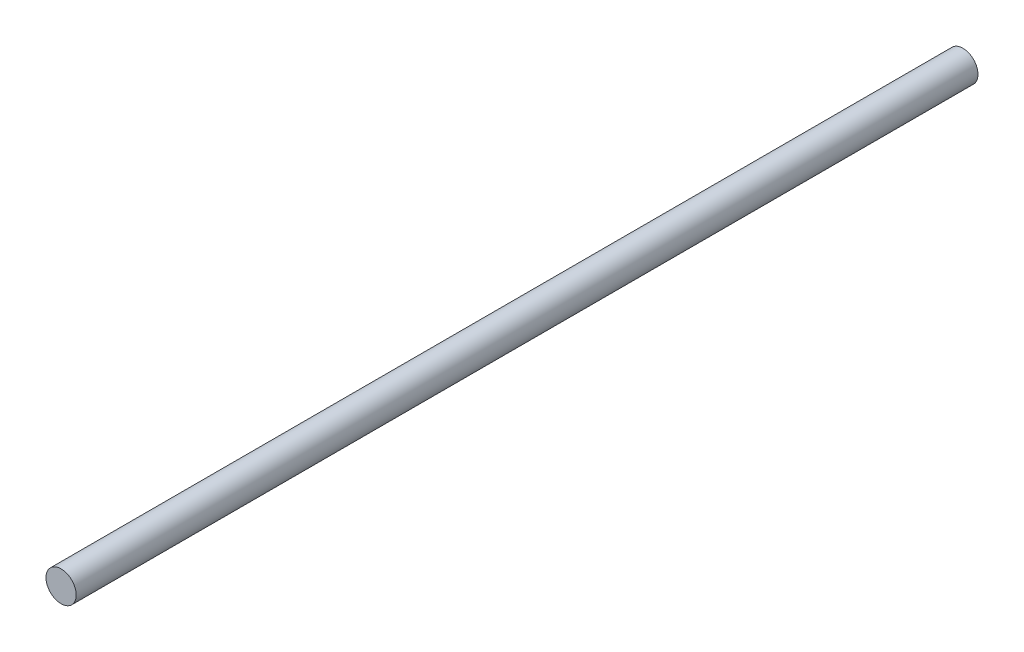
from build123d import *

# Parameters (mm, degrees)
SKETCH_1_R      = 2.5
EXTRUDE_1_DEPTH = 149.09


with BuildPart() as part:
    # 草图1 → 凸台-拉伸1 (new body)
    with BuildSketch(Plane.XY):
        Circle(SKETCH_1_R)
    extrude(amount=EXTRUDE_1_DEPTH)


solid = part.part
